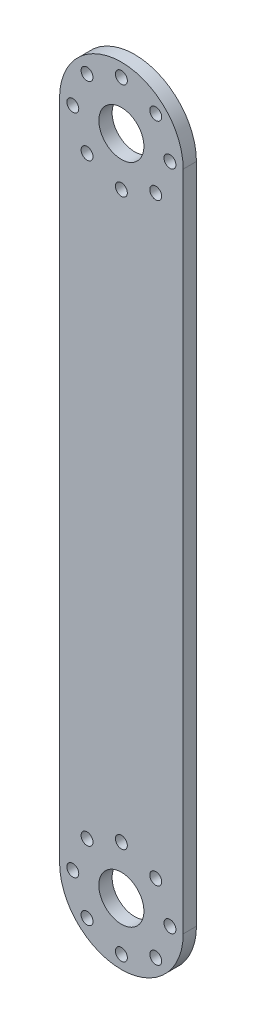
from build123d import *

# Parameters (mm, degrees)
SKETCH_1_R      = 1.35
SKETCH_1_R_2    = 5.1
EXTRUDE_1_DEPTH = 3


with BuildPart() as part:
    # 草图1 → 凸台-拉伸1 (new body)
    with BuildSketch(Plane.XY):
        with BuildLine():
            Line((-14, 0), (-14, 150))
            ThreePointArc((-14, 150), (0, 164), (14, 150))
            Line((14, 150), (14, 0))
            ThreePointArc((14, 0), (0, -14), (-14, 0))
        make_face()
        with Locations((0, 161)):
            Circle(SKETCH_1_R, mode=Mode.SUBTRACT)
        with Locations((7.778174593, 157.778174593)):
            Circle(SKETCH_1_R, mode=Mode.SUBTRACT)
        with Locations((11, 150)):
            Circle(SKETCH_1_R, mode=Mode.SUBTRACT)
        with Locations((7.778174593, 142.221825407)):
            Circle(SKETCH_1_R, mode=Mode.SUBTRACT)
        with Locations((0, 139)):
            Circle(SKETCH_1_R, mode=Mode.SUBTRACT)
        with Locations((-7.778174593, 142.221825407)):
            Circle(SKETCH_1_R, mode=Mode.SUBTRACT)
        with Locations((-11, 150)):
            Circle(SKETCH_1_R, mode=Mode.SUBTRACT)
        with Locations((-7.778174593, 157.778174593)):
            Circle(SKETCH_1_R, mode=Mode.SUBTRACT)
        with Locations((0, 150)):
            Circle(SKETCH_1_R_2, mode=Mode.SUBTRACT)
        Circle(SKETCH_1_R_2, mode=Mode.SUBTRACT)
        with Locations((0, -11)):
            Circle(SKETCH_1_R, mode=Mode.SUBTRACT)
        with Locations((-7.778174593, -7.778174593)):
            Circle(SKETCH_1_R, mode=Mode.SUBTRACT)
        with Locations((-11, 0)):
            Circle(SKETCH_1_R, mode=Mode.SUBTRACT)
        with Locations((-7.778174593, 7.778174593)):
            Circle(SKETCH_1_R, mode=Mode.SUBTRACT)
        with Locations((0, 11)):
            Circle(SKETCH_1_R, mode=Mode.SUBTRACT)
        with Locations((7.778174593, 7.778174593)):
            Circle(SKETCH_1_R, mode=Mode.SUBTRACT)
        with Locations((11, 0)):
            Circle(SKETCH_1_R, mode=Mode.SUBTRACT)
        with Locations((7.778174593, -7.778174593)):
            Circle(SKETCH_1_R, mode=Mode.SUBTRACT)
    extrude(amount=EXTRUDE_1_DEPTH)


solid = part.part
